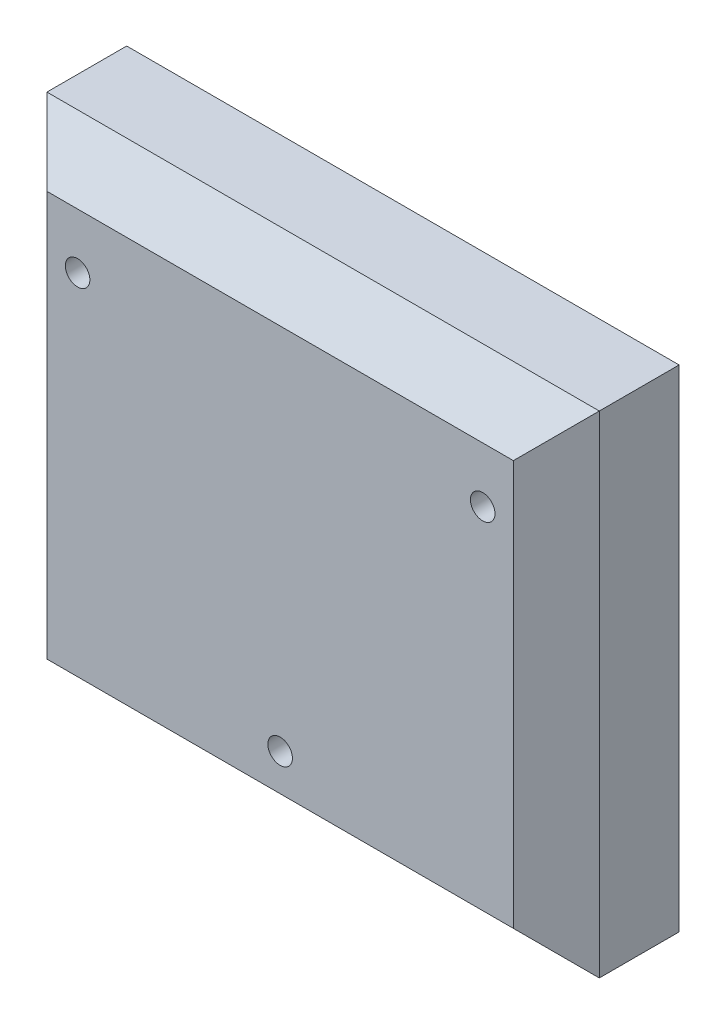
from build123d import *

# Parameters (mm, degrees)
SKETCH5_W           = 90
SKETCH5_H           = 80
BOSS_EXTRUDE4_DEPTH = 13
BOSS_EXTRUDE5_DEPTH = 80
CHAMFER1_SIZE       = 7
SKETCH13_R          = 2
CUT_EXTRUDE4_DEPTH  = 20
SKETCH14_R          = 2
CUT_EXTRUDE8_DEPTH  = 20


with BuildPart() as part:
    # Sketch5 → Boss-Extrude4 (new body)
    with BuildSketch(Plane.XY):
        with Locations((0, -5.742449829)):
            Rectangle(SKETCH5_W, SKETCH5_H)
    extrude(amount=BOSS_EXTRUDE4_DEPTH)

    # Sketch6 → Boss-Extrude5 (add, through all)
    with BuildSketch(Plane.XZ.offset(45.742449829)):
        Polygon((-45, 13), (-38, 20), (38, 20), (45, 13), (45, 0), (-45, 0), align=None)
    extrude(amount=-BOSS_EXTRUDE5_DEPTH)

    # Chamfer1
    chamfer1_edges = [part.edges().sort_by_distance(p)[0] for p in [
        (0, -45.742449829, 20),
        (0, 34.257550171, 20),
    ]]
    chamfer(chamfer1_edges, length=CHAMFER1_SIZE)

    # Sketch13 → Cut-Extrude4 (cut)
    with BuildSketch(Plane(origin=(0, 0, 0), x_dir=(-1, 0, 0), z_dir=(0, 0, -1))):
        with Locations((0, -32.742449829)):
            Circle(SKETCH13_R)
    extrude(amount=-CUT_EXTRUDE4_DEPTH, mode=Mode.SUBTRACT)

    # Sketch14 → Cut-Extrude8 (cut)
    with BuildSketch(Plane(origin=(0, 0, 0), x_dir=(-1, 0, 0), z_dir=(0, 0, -1))):
        with Locations((-33, 18.257550171)):
            Circle(SKETCH14_R)
        with Locations((33, 18.257550171)):
            Circle(SKETCH14_R)
    extrude(amount=-CUT_EXTRUDE8_DEPTH, mode=Mode.SUBTRACT)


solid = part.part
